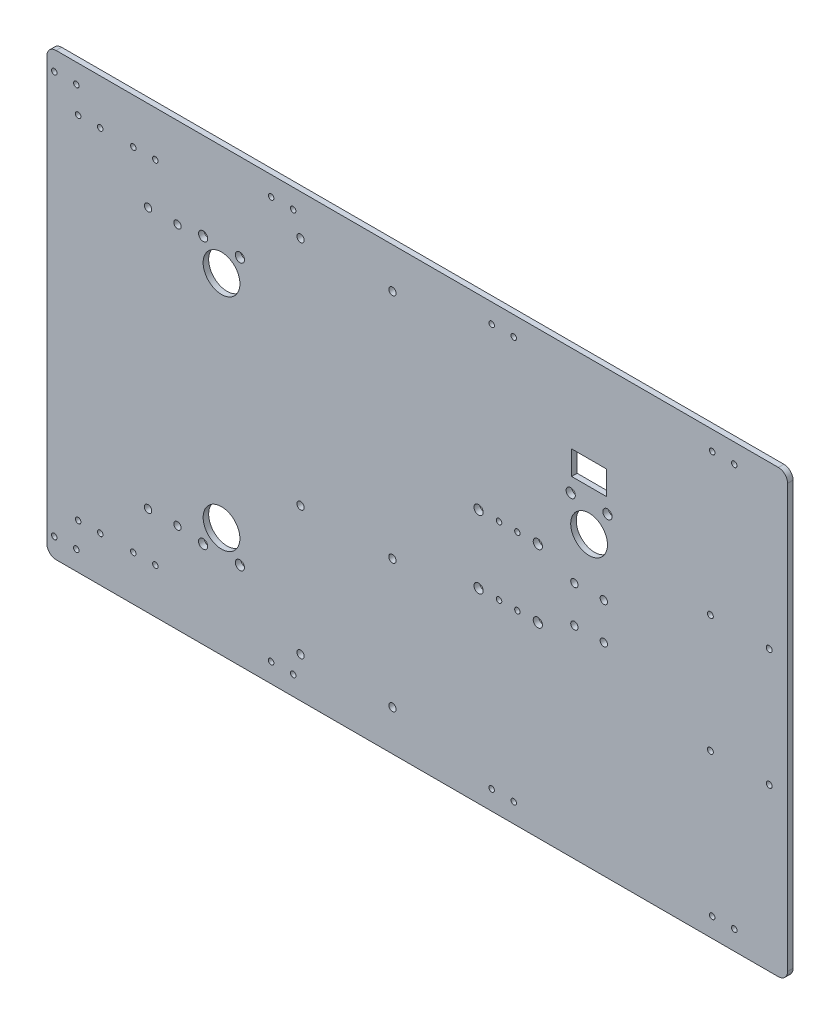
from build123d import *

# Parameters (mm, degrees)
MODEL_R         = 1.5
MODEL_R_2       = 1.6
MODEL_R_3       = 2
MODEL_R_4       = 10
MODEL_R_5       = 2.5
MODEL_W         = 19
MODEL_H         = 13
EXTRUDE_1_DEPTH = 3


with BuildPart() as part:
    # Model → 凸台-拉伸1 (new body)
    with BuildSketch(Plane.XY):
        with BuildLine():
            Line((5, 120), (398, 120))
            ThreePointArc((398, 120), (401.535533906, 118.535533906), (403, 115))
            Line((403, 115), (403, -115))
            ThreePointArc((403, -115), (401.535533906, -118.535533906), (398, -120))
            Line((398, -120), (5, -120))
            ThreePointArc((5, -120), (1.464466094, -118.535533906), (0, -115))
            Line((0, -115), (0, 115))
            ThreePointArc((0, 115), (1.464466094, 118.535533906), (5, 120))
        make_face()
        with Locations((17, 95.5)):
            Circle(MODEL_R, mode=Mode.SUBTRACT)
        with Locations((29, 95.5)):
            Circle(MODEL_R, mode=Mode.SUBTRACT)
        with Locations((47, 95.5)):
            Circle(MODEL_R, mode=Mode.SUBTRACT)
        with Locations((59, 95.5)):
            Circle(MODEL_R, mode=Mode.SUBTRACT)
        with Locations((17, -95.5)):
            Circle(MODEL_R, mode=Mode.SUBTRACT)
        with Locations((29, -95.5)):
            Circle(MODEL_R, mode=Mode.SUBTRACT)
        with Locations((47, -95.5)):
            Circle(MODEL_R, mode=Mode.SUBTRACT)
        with Locations((59, -95.5)):
            Circle(MODEL_R, mode=Mode.SUBTRACT)
        with Locations((4, 109.5)):
            Circle(MODEL_R, mode=Mode.SUBTRACT)
        with Locations((16, 109.5)):
            Circle(MODEL_R, mode=Mode.SUBTRACT)
        with Locations((4, -109.5)):
            Circle(MODEL_R, mode=Mode.SUBTRACT)
        with Locations((16, -109.5)):
            Circle(MODEL_R, mode=Mode.SUBTRACT)
        with Locations((362, 109.5)):
            Circle(MODEL_R, mode=Mode.SUBTRACT)
        with Locations((374, 109.5)):
            Circle(MODEL_R, mode=Mode.SUBTRACT)
        with Locations((362, -109.5)):
            Circle(MODEL_R, mode=Mode.SUBTRACT)
        with Locations((374, -109.5)):
            Circle(MODEL_R, mode=Mode.SUBTRACT)
        with Locations((361, 32)):
            Circle(MODEL_R_2, mode=Mode.SUBTRACT)
        with Locations((393, 32)):
            Circle(MODEL_R_2, mode=Mode.SUBTRACT)
        with Locations((393, -32)):
            Circle(MODEL_R_2, mode=Mode.SUBTRACT)
        with Locations((361, -32)):
            Circle(MODEL_R_2, mode=Mode.SUBTRACT)
        with Locations((188, 98)):
            Circle(MODEL_R_3, mode=Mode.SUBTRACT)
        with Locations((138, 98)):
            Circle(MODEL_R_3, mode=Mode.SUBTRACT)
        with Locations((254, 109.5)):
            Circle(MODEL_R, mode=Mode.SUBTRACT)
        with Locations((242, 109.5)):
            Circle(MODEL_R, mode=Mode.SUBTRACT)
        with Locations((188, -98)):
            Circle(MODEL_R_3, mode=Mode.SUBTRACT)
        with Locations((138, -98)):
            Circle(MODEL_R_3, mode=Mode.SUBTRACT)
        with Locations((138, -28)):
            Circle(MODEL_R_3, mode=Mode.SUBTRACT)
        with Locations((188, -28)):
            Circle(MODEL_R_3, mode=Mode.SUBTRACT)
        with Locations((295, 37)):
            Circle(MODEL_R_4, mode=Mode.SUBTRACT)
        with Locations((285, 51.5)):
            Circle(MODEL_R_5, mode=Mode.SUBTRACT)
        with Locations((305, 51.5)):
            Circle(MODEL_R_5, mode=Mode.SUBTRACT)
        with Locations((256, 18.5)):
            Circle(MODEL_R, mode=Mode.SUBTRACT)
        with Locations((246, 18.5)):
            Circle(MODEL_R, mode=Mode.SUBTRACT)
        with Locations((256, -18.5)):
            Circle(MODEL_R, mode=Mode.SUBTRACT)
        with Locations((246, -18.5)):
            Circle(MODEL_R, mode=Mode.SUBTRACT)
        with Locations((95, 60)):
            Circle(MODEL_R_4, mode=Mode.SUBTRACT)
        with Locations((105, 72.5)):
            Circle(MODEL_R_5, mode=Mode.SUBTRACT)
        with Locations((85, 72.5)):
            Circle(MODEL_R_5, mode=Mode.SUBTRACT)
        with Locations((95, -60)):
            Circle(MODEL_R_4, mode=Mode.SUBTRACT)
        with Locations((105, -72.5)):
            Circle(MODEL_R_5, mode=Mode.SUBTRACT)
        with Locations((85, -72.5)):
            Circle(MODEL_R_5, mode=Mode.SUBTRACT)
        with Locations((134, 109.5)):
            Circle(MODEL_R, mode=Mode.SUBTRACT)
        with Locations((122, 109.5)):
            Circle(MODEL_R, mode=Mode.SUBTRACT)
        with Locations((287, 10)):
            Circle(MODEL_R_3, mode=Mode.SUBTRACT)
        with Locations((303, 10)):
            Circle(MODEL_R_3, mode=Mode.SUBTRACT)
        with Locations((303, -10)):
            Circle(MODEL_R_3, mode=Mode.SUBTRACT)
        with Locations((287, -10)):
            Circle(MODEL_R_3, mode=Mode.SUBTRACT)
        with Locations((55.030468906, 71.000464285)):
            Circle(MODEL_R_3, mode=Mode.SUBTRACT)
        with Locations((71.030468906, 71.000464285)):
            Circle(MODEL_R_3, mode=Mode.SUBTRACT)
        with Locations((55.030468906, -71.000464285)):
            Circle(MODEL_R_3, mode=Mode.SUBTRACT)
        with Locations((71.030468906, -71.000464285)):
            Circle(MODEL_R_3, mode=Mode.SUBTRACT)
        with Locations((254, -109.5)):
            Circle(MODEL_R, mode=Mode.SUBTRACT)
        with Locations((242, -109.5)):
            Circle(MODEL_R, mode=Mode.SUBTRACT)
        with Locations((134, -109.5)):
            Circle(MODEL_R, mode=Mode.SUBTRACT)
        with Locations((122, -109.5)):
            Circle(MODEL_R, mode=Mode.SUBTRACT)
        with Locations((267.106872725, 18.5)):
            Circle(MODEL_R_5, mode=Mode.SUBTRACT)
        with Locations((234.893127275, 18.5)):
            Circle(MODEL_R_5, mode=Mode.SUBTRACT)
        with Locations((267.106872725, -18.5)):
            Circle(MODEL_R_5, mode=Mode.SUBTRACT)
        with Locations((234.893127275, -18.5)):
            Circle(MODEL_R_5, mode=Mode.SUBTRACT)
        with Locations((295, 66)):
            Rectangle(MODEL_W, MODEL_H, mode=Mode.SUBTRACT)
    extrude(amount=EXTRUDE_1_DEPTH)


solid = part.part
